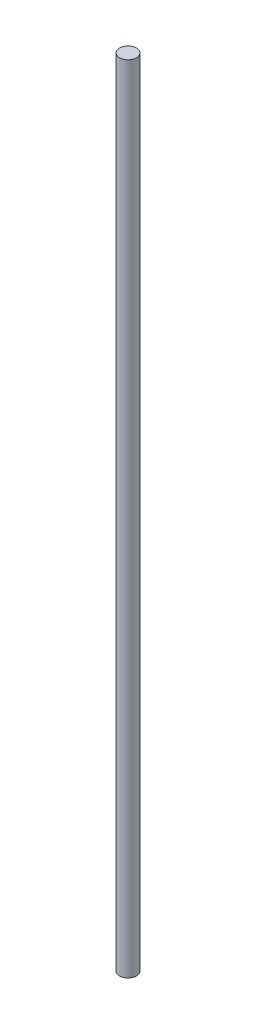
from build123d import *

# Parameters (mm, degrees)
SKETCH1_R           = 6.35
BOSS_EXTRUDE1_DEPTH = 596.9


with BuildPart() as part:
    # Sketch1 → Boss-Extrude1 (new body)
    with BuildSketch(Plane(origin=(0, 0, 0), x_dir=(1, 0, 0), z_dir=(0, 1, 0))):
        with Locations(Location((0, 0, 0), (0, 0, 270))):
            Circle(SKETCH1_R)
    extrude(amount=BOSS_EXTRUDE1_DEPTH)


solid = part.part
